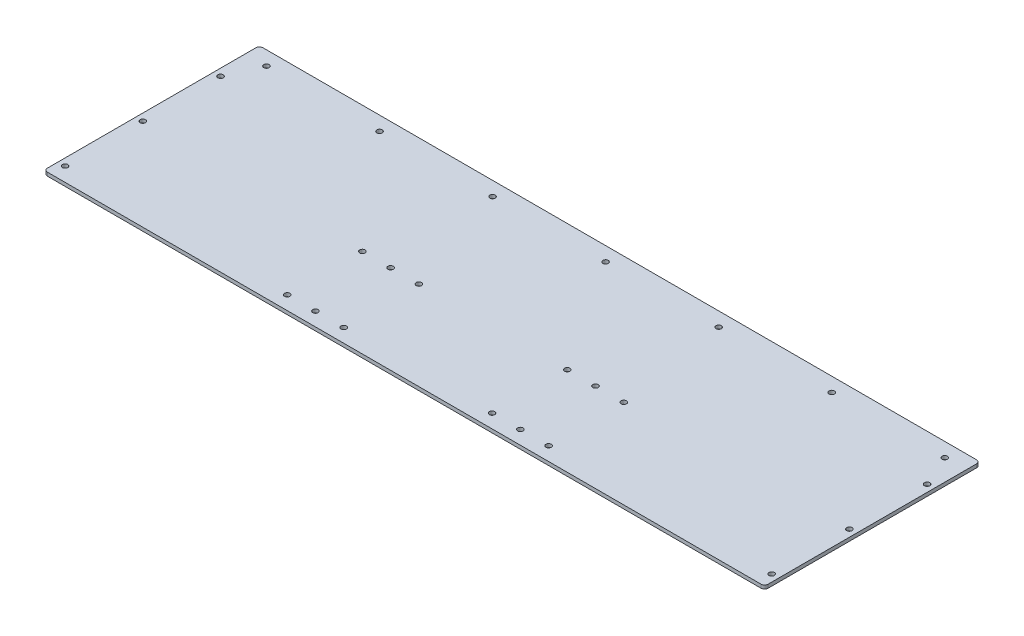
from build123d import *

# Parameters (mm, degrees)
SKETCH1_W           = 647.7
SKETCH1_H           = 193.675
SKETCH1_R           = 2.4257
BOSS_EXTRUDE1_DEPTH = 3.175
SKETCH2_R           = 2.4257
CUT_EXTRUDE1_DEPTH  = 677.043915918
FILLET1_R           = 3.175


with BuildPart() as part:
    # Sketch1 → Boss-Extrude1 (new body)
    with BuildSketch(Plane(origin=(0, 0, 0), x_dir=(1, 0, 0), z_dir=(0, 1, 0))):
        with Locations((323.85, 96.8375)):
            Rectangle(SKETCH1_W, SKETCH1_H)
        with Locations(Location((231.775, 12.2555, 0), (0, 0, 270))):
            Circle(SKETCH1_R, mode=Mode.SUBTRACT)
        with Locations(Location((257.175, 12.2555, 0), (0, 0, 270))):
            Circle(SKETCH1_R, mode=Mode.SUBTRACT)
        with Locations(Location((206.375, 12.2555, 0), (0, 0, 90))):
            Circle(SKETCH1_R, mode=Mode.SUBTRACT)
        with Locations(Location((257.175, 79.8195, 0), (0, 0, 90))):
            Circle(SKETCH1_R, mode=Mode.SUBTRACT)
        with Locations(Location((231.775, 79.8195, 0), (0, 0, 90))):
            Circle(SKETCH1_R, mode=Mode.SUBTRACT)
        with Locations(Location((206.375, 79.8195, 0), (0, 0, 270))):
            Circle(SKETCH1_R, mode=Mode.SUBTRACT)
        with Locations(Location((323.85, 180.975, 0), (0, 0, 270))):
            Circle(SKETCH1_R, mode=Mode.SUBTRACT)
        with Locations(Location((425.45, 180.975, 0), (0, 0, 270))):
            Circle(SKETCH1_R, mode=Mode.SUBTRACT)
        with Locations(Location((527.05, 180.975, 0), (0, 0, 270))):
            Circle(SKETCH1_R, mode=Mode.SUBTRACT)
        with Locations(Location((120.65, 180.975, 0), (0, 0, 90))):
            Circle(SKETCH1_R, mode=Mode.SUBTRACT)
        with Locations(Location((222.25, 180.975, 0), (0, 0, 90))):
            Circle(SKETCH1_R, mode=Mode.SUBTRACT)
        with Locations(Location((628.65, 180.975, 0), (0, 0, 270))):
            Circle(SKETCH1_R, mode=Mode.SUBTRACT)
        with Locations(Location((19.05, 180.975, 0), (0, 0, 90))):
            Circle(SKETCH1_R, mode=Mode.SUBTRACT)
        with Locations(Location((441.325, 79.8195, 0), (0, 0, 90))):
            Circle(SKETCH1_R, mode=Mode.SUBTRACT)
        with Locations(Location((415.925, 79.8195, 0), (0, 0, 270))):
            Circle(SKETCH1_R, mode=Mode.SUBTRACT)
        with Locations(Location((390.525, 79.8195, 0), (0, 0, 270))):
            Circle(SKETCH1_R, mode=Mode.SUBTRACT)
        with Locations(Location((441.325, 12.2555, 0), (0, 0, 270))):
            Circle(SKETCH1_R, mode=Mode.SUBTRACT)
        with Locations(Location((390.525, 12.2555, 0), (0, 0, 90))):
            Circle(SKETCH1_R, mode=Mode.SUBTRACT)
        with Locations(Location((415.925, 12.2555, 0), (0, 0, 90))):
            Circle(SKETCH1_R, mode=Mode.SUBTRACT)
    extrude(amount=BOSS_EXTRUDE1_DEPTH)

    # Sketch2 → Cut-Extrude1 (cut, through all)
    with BuildSketch(Plane(origin=(0, 3.175, 0), x_dir=(1, 0, 0), z_dir=(0, 1, 0))):
        with Locations(Location((6.35, 12.7, 0), (0, 0, 270))):
            Circle(SKETCH2_R)
        with Locations(Location((6.35, 82.55, 0), (0, 0, 270))):
            Circle(SKETCH2_R)
        with Locations(Location((6.35, 152.4, 0), (0, 0, 270))):
            Circle(SKETCH2_R)
        with Locations((6.35, 222.25)):
            Circle(SKETCH2_R)
        with Locations((641.35, 222.25)):
            Circle(SKETCH2_R)
        with Locations(Location((641.35, 152.4, 0), (0, 0, 90))):
            Circle(SKETCH2_R)
        with Locations(Location((641.35, 82.55, 0), (0, 0, 90))):
            Circle(SKETCH2_R)
        with Locations(Location((641.35, 12.7, 0), (0, 0, 90))):
            Circle(SKETCH2_R)
    extrude(amount=-CUT_EXTRUDE1_DEPTH, mode=Mode.SUBTRACT)

    # Fillet1
    fillet1_edges = [part.edges().sort_by_distance(p)[0] for p in [
        (0, 1.5875, -193.675),
        (647.7, 1.5875, -193.675),
        (647.7, 1.5875, 0),
        (0, 1.5875, 0),
    ]]
    fillet(fillet1_edges, radius=FILLET1_R)


solid = part.part
